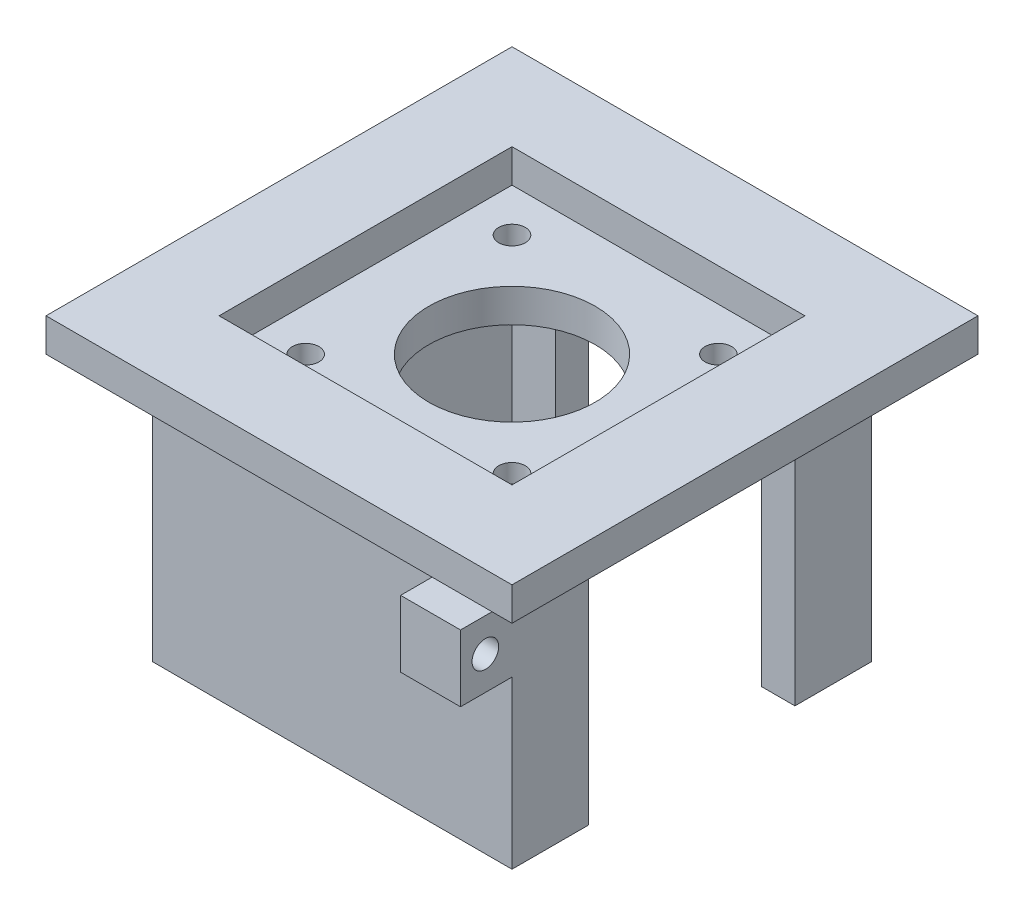
from build123d import *

# Parameters (mm, degrees)
EXTRUDE_1_DEPTH          = 10
EXTRUDE_1_DEPTH_BACK     = 35
SKETCH_1_W               = 56
SKETCH_1_H               = 56
SKETCH_1_W_2             = 44
SKETCH_1_H_2             = 44
SKETCH_3_W               = 70
SKETCH_3_H               = 70
SKETCH_3_W_2             = 54
SKETCH_3_H_2             = 54
EXTRUDE_2_DEPTH          = 10
CUT_EXTRUDE_1_DEPTH      = 5
CUT_EXTRUDE_1_DEPTH_BACK = 40
SKETCH_3_2_W             = 70
SKETCH_3_2_H             = 70
SKETCH_3_2_W_2           = 54
SKETCH_3_2_H_2           = 54
SKETCH_4_W               = 47.606985224
SKETCH_4_H               = 48.466705047
SKETCH_4_R               = 12.5
SKETCH_4_R_2             = 2
EXTRUDE_3_DEPTH          = 5
CUT_EXTRUDE_2_DEPTH      = 50
SKETCH_6_W               = 12.5
SKETCH_6_H               = 9
SKETCH_6_W_2             = 9
SKETCH_6_H_2             = 12.5
EXTRUDE_4_DEPTH          = 10
SKETCH_7_R               = 2
CUT_EXTRUDE_3_DEPTH      = 1000
SKETCH_8_R               = 2
CUT_EXTRUDE_4_DEPTH      = 1000


with BuildPart() as part:
    # Эскиз1 → Бобышка-Вытянуть1 (new, two sides: drawn at the far end of the back side and taken through both)
    with BuildSketch(Plane(origin=(0, 0, 0), x_dir=(1, 0, 0), z_dir=(0, 1, 0)).offset(-EXTRUDE_1_DEPTH_BACK)):
        Rectangle(SKETCH_1_W, SKETCH_1_H)
        Rectangle(SKETCH_1_W_2, SKETCH_1_H_2, mode=Mode.SUBTRACT)
    extrude(amount=EXTRUDE_1_DEPTH + EXTRUDE_1_DEPTH_BACK)

    # Эскиз3 → Бобышка-Вытянуть2 (add)
    with BuildSketch(Plane(origin=(0, 0, 0), x_dir=(1, 0, 0), z_dir=(0, 1, 0))):
        Rectangle(SKETCH_3_W, SKETCH_3_H)
        Rectangle(SKETCH_3_W_2, SKETCH_3_H_2, mode=Mode.SUBTRACT)
    extrude(amount=EXTRUDE_2_DEPTH)

    # Эскиз3<2> → Вырез-Вытянуть1 (cut, two sides: drawn at the far end of the back side and taken through both)
    with BuildSketch(Plane(origin=(0, 0, 0), x_dir=(1, 0, 0), z_dir=(0, 1, 0)).offset(-CUT_EXTRUDE_1_DEPTH_BACK)):
        Rectangle(SKETCH_3_2_W, SKETCH_3_2_H)
        Rectangle(SKETCH_3_2_W_2, SKETCH_3_2_H_2, mode=Mode.SUBTRACT)
    extrude(amount=CUT_EXTRUDE_1_DEPTH + CUT_EXTRUDE_1_DEPTH_BACK, mode=Mode.SUBTRACT)

    # Эскиз4 → Бобышка-Вытянуть3 (add)
    with BuildSketch(Plane(origin=(0, 0, 0), x_dir=(1, 0, 0), z_dir=(0, 1, 0))):
        with Locations((0.268662445, 0.4835924)):
            Rectangle(SKETCH_4_W, SKETCH_4_H)
        Circle(SKETCH_4_R, mode=Mode.SUBTRACT)
        with Locations((-15.5, 15.5)):
            Circle(SKETCH_4_R_2, mode=Mode.SUBTRACT)
        with Locations((-15.5, -15.5)):
            Circle(SKETCH_4_R_2, mode=Mode.SUBTRACT)
        with Locations((15.5, -15.5)):
            Circle(SKETCH_4_R_2, mode=Mode.SUBTRACT)
        with Locations((15.5, 15.5)):
            Circle(SKETCH_4_R_2, mode=Mode.SUBTRACT)
    extrude(amount=EXTRUDE_3_DEPTH)

    # Эскиз5 → Вырез-Вытянуть2 (cut)
    with BuildSketch(Plane(origin=(0, 0, 0), x_dir=(1, 0, 0), z_dir=(0, 1, 0))):
        Polygon((-15.5, -15.5), (45.904177047, -15.5), (45.904177047, 15.5), (15.5, 15.5), (15.5, 51.810948834), (-15.5, 51.810948834), align=None)
    extrude(amount=-CUT_EXTRUDE_2_DEPTH, mode=Mode.SUBTRACT)

    # Эскиз6 → Бобышка-Вытянуть4 (add)
    with BuildSketch(Plane(origin=(0, 0, 0), x_dir=(1, 0, 0), z_dir=(0, 1, 0))):
        with Locations((-28.3864137, 22.5)):
            Rectangle(SKETCH_6_W, SKETCH_6_H)
        with Locations((22.5, -28.484371776)):
            Rectangle(SKETCH_6_W_2, SKETCH_6_H_2)
    extrude(amount=-EXTRUDE_4_DEPTH)

    # Эскиз7 → Вырез-Вытянуть3 (cut)
    with BuildSketch(Plane(origin=(0, 0, 0), x_dir=(0, 0, -1), z_dir=(1, 0, 0))):
        with Locations((-31, -5)):
            Circle(SKETCH_7_R)
    extrude(amount=CUT_EXTRUDE_3_DEPTH, mode=Mode.SUBTRACT)

    # Эскиз8 → Вырез-Вытянуть4 (cut)
    with BuildSketch(Plane.XY):
        with Locations((-31, -5)):
            Circle(SKETCH_8_R)
    extrude(amount=-CUT_EXTRUDE_4_DEPTH, mode=Mode.SUBTRACT)


solid = part.part
